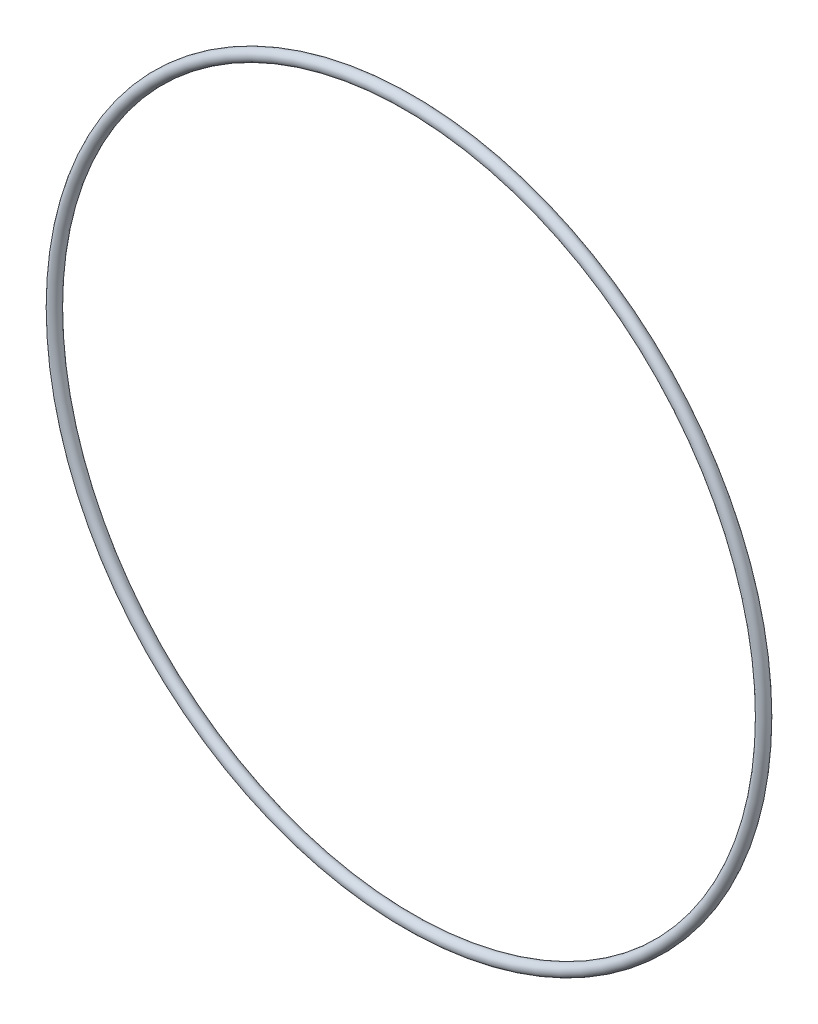
from build123d import *

# Parameters (mm, degrees)
SKETCH2_R = 0.75


with BuildPart() as part:
    # Sketch2 → Revolve1 (revolve)
    with BuildSketch(Plane(origin=(0, 0, 0), x_dir=(1, 0, 0), z_dir=(0, 1, 0)), mode=Mode.PRIVATE) as revolve1_sk:
        with Locations((45.75, 0)):
            Circle(SKETCH2_R)
    revolve(revolve1_sk.sketch.rotate(Axis((0, 0, -0.75), (0, 0, 1)), 180), axis=Axis((0, 0, -0.75), (0, 0, 1)))


solid = part.part
